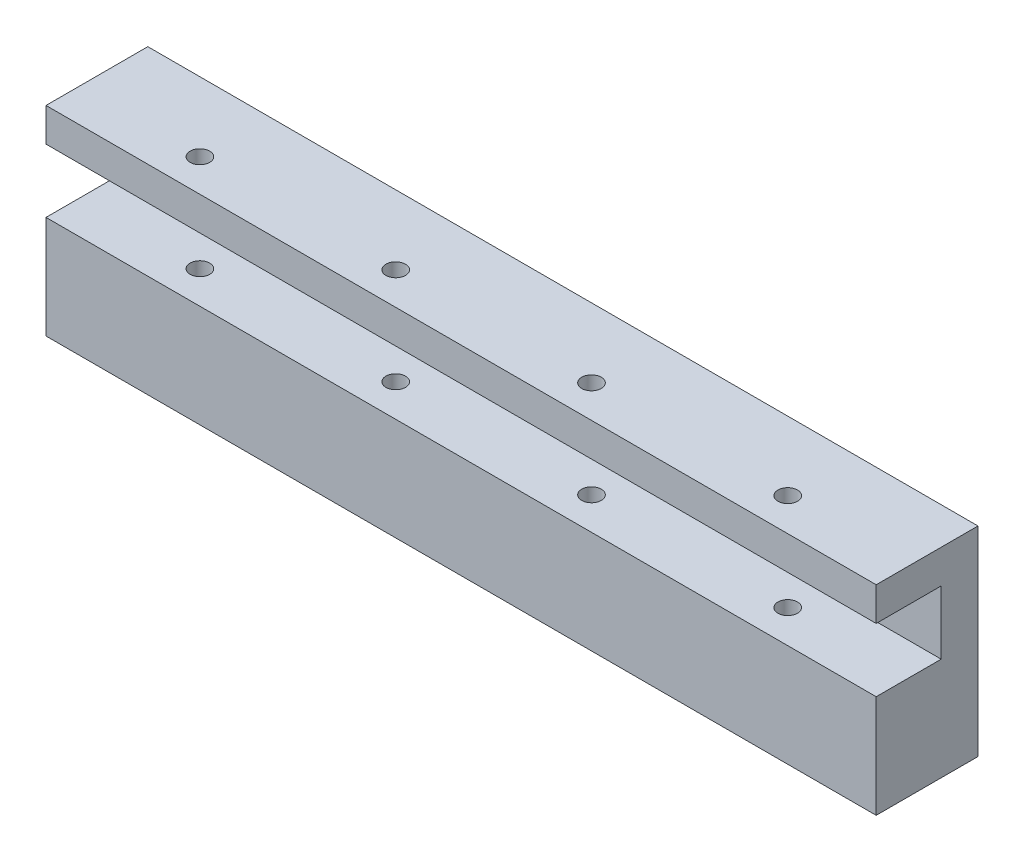
from build123d import *

# Parameters (mm, degrees)
SKETCH4_W               = 106
SKETCH4_H               = 25.5
BOSS_EXTRUDE2_DEPTH     = 13
CUT_EXTRUDE3_DEPTH      = 101.130030155
CUT_EXTRUDE3_DEPTH_BACK = 8.3
SKETCH25_W              = 106
SKETCH25_H              = 8.1
M3X0_5_TAPPED_HOLE1_D   = 2.5


with BuildPart() as part:
    # Sketch4 → Boss-Extrude2 (new body)
    with BuildSketch(Plane.XY):
        with Locations((-36.891047602, -29.4)):
            Rectangle(SKETCH4_W, SKETCH4_H)
    extrude(amount=-BOSS_EXTRUDE2_DEPTH)

    # Sketch25 → Cut-Extrude3 (cut, two sides: drawn at the far end of the back side and taken through both)
    with BuildSketch(Plane.XY.offset(-CUT_EXTRUDE3_DEPTH_BACK)):
        with Locations((-36.891047602, -24.98)):
            Rectangle(SKETCH25_W, SKETCH25_H)
    extrude(amount=CUT_EXTRUDE3_DEPTH + CUT_EXTRUDE3_DEPTH_BACK, mode=Mode.SUBTRACT)

    # M3x0.5 Tapped Hole1 (through all)
    with Locations(Plane(origin=(-74.390985602, -16.65, -4.15), x_dir=(0, 0, 1), z_dir=(0, 1, 0))):
        with Locations((0, 0), (0, 25), (-0.055677319, 74.999938), (0, 50)):
            Hole(M3X0_5_TAPPED_HOLE1_D / 2)


solid = part.part
